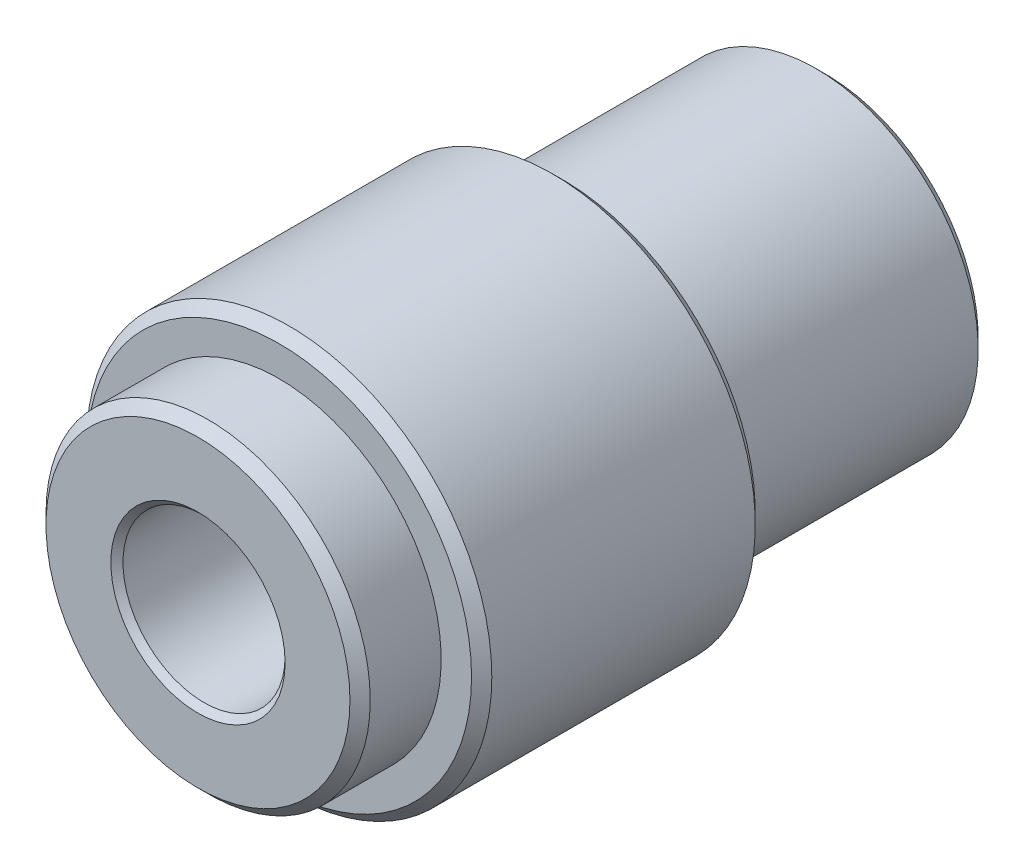
from build123d import *

# Parameters (mm, degrees)
CHAMFER_1_SIZE      = 0.25
SKETCH_2_R          = 2
CUT_EXTRUDE_1_DEPTH = 18.036725037
CHAMFER_2_SIZE      = 0.15


with BuildPart() as part:
    # ｽｹｯﾁ1 → 回転1 (revolve)
    with BuildSketch(Plane(origin=(0, 0, 0), x_dir=(0, 0, -1), z_dir=(1, 0, 0)), mode=Mode.PRIVATE) as revolve_1_sk:
        Polygon((0, 0), (0, 4), (2, 4), (2, 5), (9, 5), (9, 4), (15.5, 4), (15.5, 0), align=None)
    revolve(revolve_1_sk.sketch.rotate(Axis((0, 0, -15.5), (0, 0, 1)), 90), axis=Axis((0, 0, -15.5), (0, 0, 1)))

    # 面取り1
    chamfer_1_edges = [part.edges().sort_by_distance(p)[0] for p in [
        (4, 0, -15.5),
        (5, 0, -9),
        (5, 0, -2),
        (4, 0, 0),
    ]]
    chamfer(chamfer_1_edges, length=CHAMFER_1_SIZE)

    # ｽｹｯﾁ2 → ｶｯﾄ - 押し出し1 (cut, through all)
    with BuildSketch(Plane.XY):
        Circle(SKETCH_2_R)
    extrude(amount=-CUT_EXTRUDE_1_DEPTH, mode=Mode.SUBTRACT)

    # 面取り2
    chamfer_2_edges = [part.edges().sort_by_distance(p)[0] for p in [
        (-2, 0, -15.5),
        (-2, 0, 0),
    ]]
    chamfer(chamfer_2_edges, length=CHAMFER_2_SIZE)


solid = part.part
